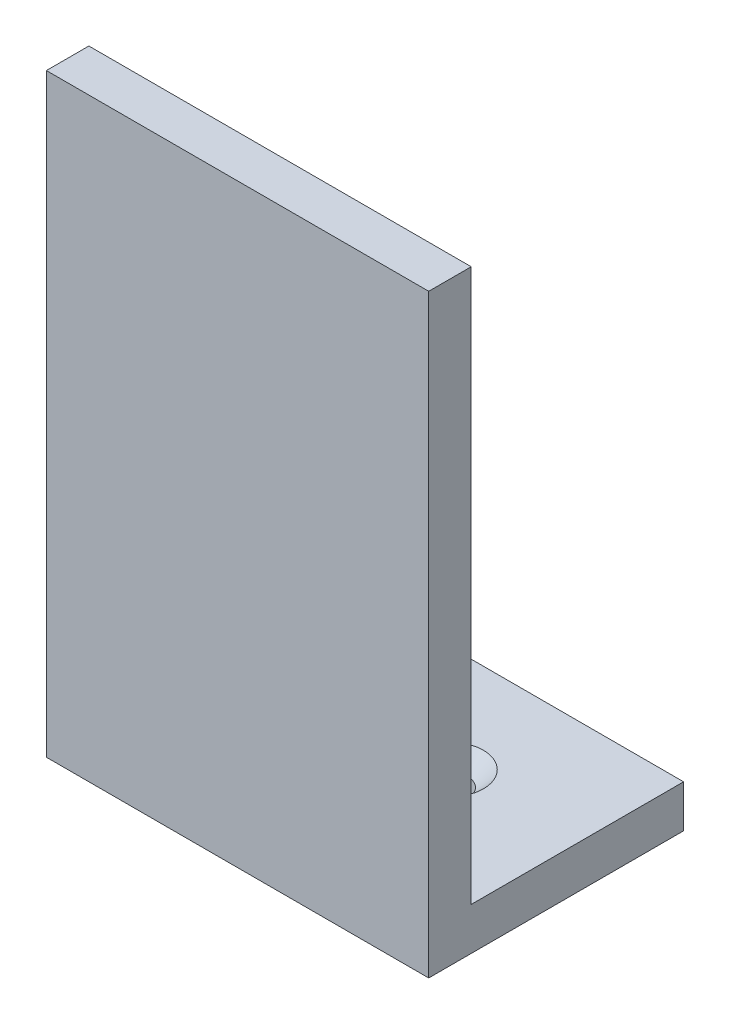
from build123d import *

# Parameters (mm, degrees)
SKETCH1_W                                           = 36
SKETCH1_H                                           = 56
BOSS_EXTRUDE1_DEPTH                                 = 4
SKETCH2_W                                           = 36
SKETCH2_H                                           = 4
BOSS_EXTRUDE2_DEPTH                                 = 20
CSK_FOR_M3_COUNTERSUNK_FLAT_HEAD_SCREW1_D           = 3.4
CSK_FOR_M3_COUNTERSUNK_FLAT_HEAD_SCREW1_CSINK_D     = 6.3
CSK_FOR_M3_COUNTERSUNK_FLAT_HEAD_SCREW1_CSINK_ANGLE = 90


with BuildPart() as part:
    # Sketch1 → Boss-Extrude1 (new body)
    with BuildSketch(Plane.XY):
        Rectangle(SKETCH1_W, SKETCH1_H)
    extrude(amount=BOSS_EXTRUDE1_DEPTH)

    # Sketch2 → Boss-Extrude2 (add)
    with BuildSketch(Plane(origin=(0, 0, 0), x_dir=(-1, 0, 0), z_dir=(0, 0, -1))):
        with Locations((0, -26)):
            Rectangle(SKETCH2_W, SKETCH2_H)
    extrude(amount=BOSS_EXTRUDE2_DEPTH)

    # CSK for M3 Countersunk Flat Head Screw1 (through all)
    with Locations(Plane(origin=(0, -24, 0), x_dir=(1, 0, 0), z_dir=(0, 1, 0))):
        with Locations((6, 10), (-6, 10)):
            CounterSinkHole(CSK_FOR_M3_COUNTERSUNK_FLAT_HEAD_SCREW1_D / 2, CSK_FOR_M3_COUNTERSUNK_FLAT_HEAD_SCREW1_CSINK_D / 2, counter_sink_angle=CSK_FOR_M3_COUNTERSUNK_FLAT_HEAD_SCREW1_CSINK_ANGLE)


solid = part.part
